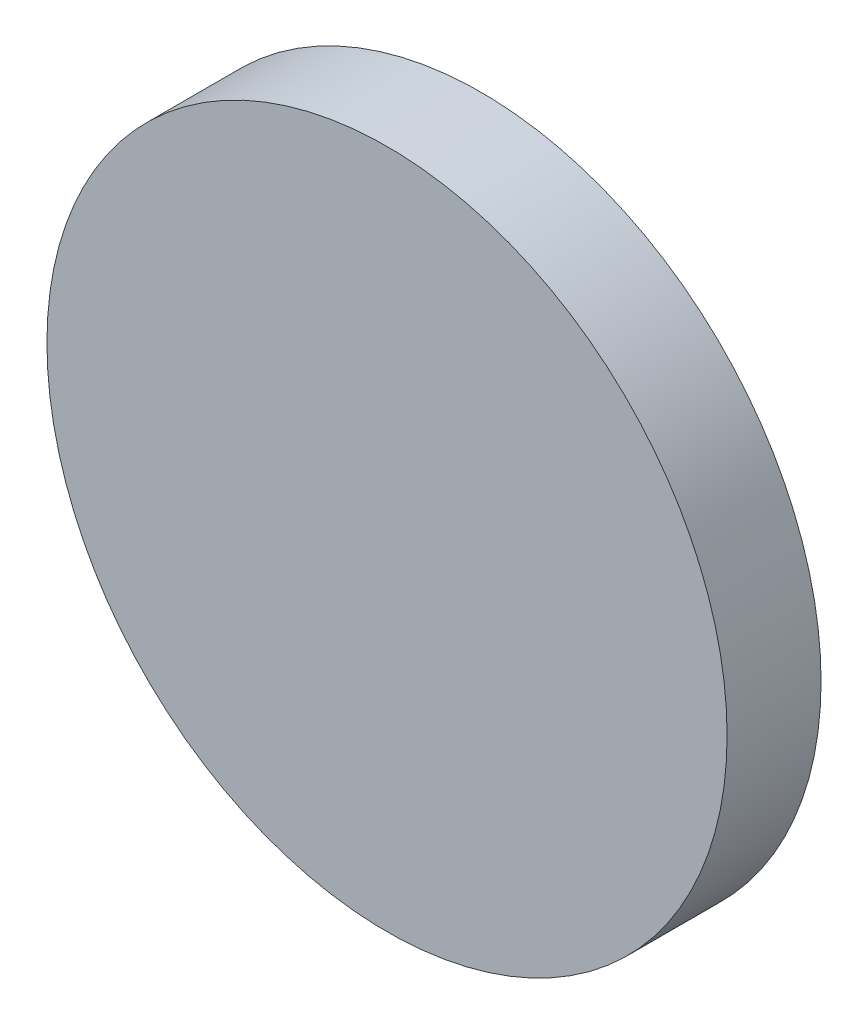
from build123d import *

# Parameters (mm, degrees)
SKETCH2_R           = 11.4935
BOSS_EXTRUDE1_DEPTH = 3.175


with BuildPart() as part:
    # Sketch2 → Boss-Extrude1 (new body)
    with BuildSketch(Plane.XY):
        Circle(SKETCH2_R)
    extrude(amount=BOSS_EXTRUDE1_DEPTH)


solid = part.part
